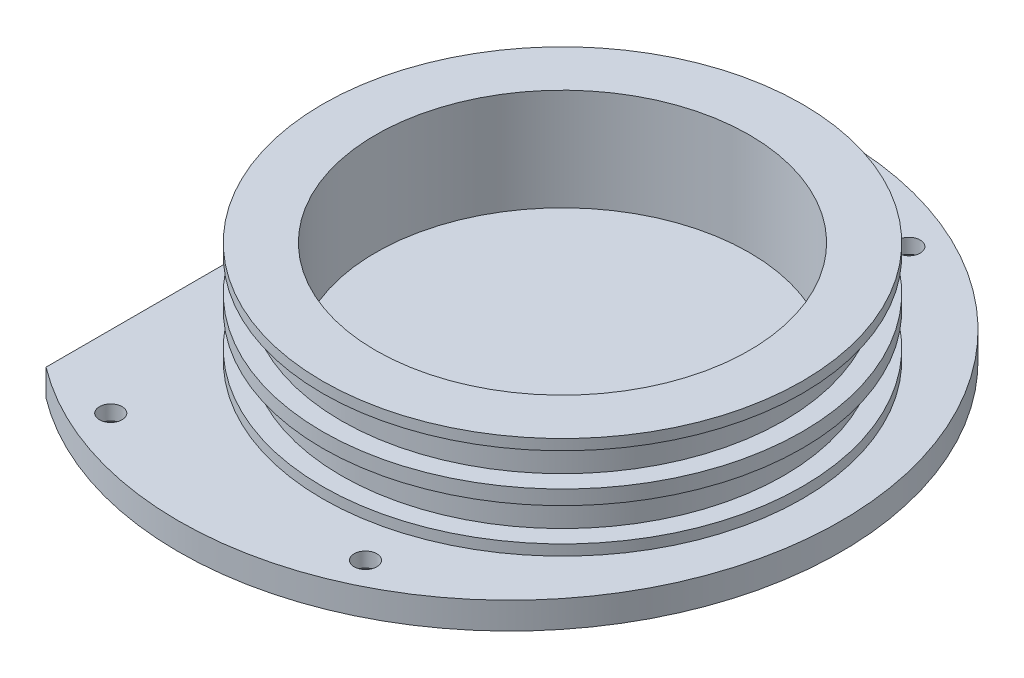
from build123d import *

# Parameters (mm, degrees)
BOSS_EXTRUDE1_DEPTH                             = 4
SKETCH2_R                                       = 35.885499984
SKETCH2_R_2                                     = 27.94
BOSS_EXTRUDE2_DEPTH                             = 15.24
SKETCH5_W                                       = 2.8067
SKETCH5_H                                       = 4.953
SKETCH10_W                                      = 10.702500058
SKETCH10_H                                      = 79.03151748
CUT_EXTRUDE2_DEPTH                              = 72.905773325
CSK_FOR_M3_FLAT_HEAD_MACHINE_SCREW1_D           = 3.4
CSK_FOR_M3_FLAT_HEAD_MACHINE_SCREW1_CSINK_D     = 7
CSK_FOR_M3_FLAT_HEAD_MACHINE_SCREW1_CSINK_ANGLE = 90


with BuildPart() as part:
    # Sketch1 → Boss-Extrude1 (new body)
    with BuildSketch(Plane(origin=(0, 0, 0), x_dir=(1, 0, 0), z_dir=(0, 1, 0))):
        with BuildLine():
            Line((-48.446276818, 28.421125), (-48.446276818, 0))
            Line((-48.446276818, 0), (41.648, 0))
            ThreePointArc((41.648, 0), (7.018876975, 47.235418548), (-48.446276818, 28.421125))
        make_face()
        with BuildLine():
            Line((41.648, 0), (-48.446276818, 0))
            Line((-48.446276818, 0), (-48.446276818, -28.421125))
            ThreePointArc((-48.446276818, -28.421125), (7.018876975, -47.235418548), (41.648, 0))
        make_face()
    extrude(amount=BOSS_EXTRUDE1_DEPTH)

    # Sketch2 → Boss-Extrude2 (add)
    with BuildSketch(Plane(origin=(0, 4, 0), x_dir=(1, 0, 0), z_dir=(0, 1, 0))):
        with Locations(Location((0, 0, 0), (0, 0, 90))):
            Circle(SKETCH2_R)
        with Locations(Location((0, 0, 0), (0, 0, 90))):
            Circle(SKETCH2_R_2, mode=Mode.SUBTRACT)
    extrude(amount=BOSS_EXTRUDE2_DEPTH)

    # Sketch5 → Cut-Revolve1 (revolve, cut)
    with BuildSketch(Plane(origin=(0, 0, 0), x_dir=(0, 0, -1), z_dir=(1, 0, 0)), mode=Mode.PRIVATE) as cut_revolve1_sk:
        with Locations((-34.482149984, 8.064)):
            Rectangle(SKETCH5_W, SKETCH5_H)
        with Locations((-34.482149984, 15.176)):
            Rectangle(SKETCH5_W, SKETCH5_H)
    revolve(cut_revolve1_sk.sketch.rotate(Axis((0, 19.24, 0), (0, -1, 0)), 180), axis=Axis((0, 19.24, 0), (0, -1, 0)), mode=Mode.SUBTRACT)

    # Sketch10 → Cut-Extrude2 (cut, through all)
    with BuildSketch(Plane.XZ):
        with Locations((-43.095026789, 0)):
            Rectangle(SKETCH10_W, SKETCH10_H)
    extrude(amount=-CUT_EXTRUDE2_DEPTH, mode=Mode.SUBTRACT)

    # CSK for M3 Flat Head Machine Screw1 (through all)
    with Locations(Plane(origin=(0, 0, 0), x_dir=(-1, 0, 0), z_dir=(0, -1, 0))):
        with Locations((26.932, -40.64), (-11.168, -40.64), (-11.168, 40.64), (26.932, 40.64)):
            CounterSinkHole(CSK_FOR_M3_FLAT_HEAD_MACHINE_SCREW1_D / 2, CSK_FOR_M3_FLAT_HEAD_MACHINE_SCREW1_CSINK_D / 2, counter_sink_angle=CSK_FOR_M3_FLAT_HEAD_MACHINE_SCREW1_CSINK_ANGLE)


solid = part.part
